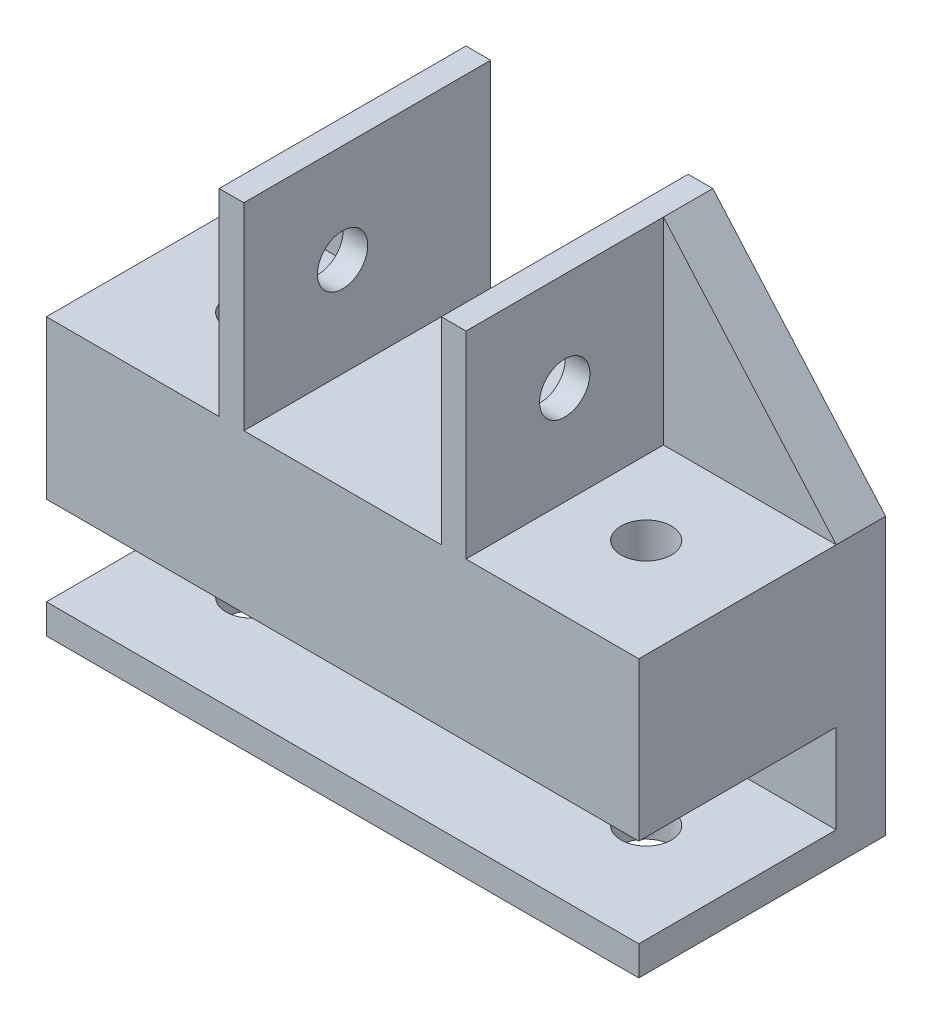
from build123d import *

# Parameters (mm, degrees)
SKETCH1_W             = 20
SKETCH1_H             = 25
BOSS_EXTRUDE1_DEPTH   = 20
BOSS_EXTRUDE1_2_DEPTH = 20
SKETCH1_3_W           = 20
SKETCH1_3_H           = 25
BOSS_EXTRUDE2_DEPTH   = 28
SKETCH2_W             = 60
SKETCH2_H             = 9
CUT_EXTRUDE1_DEPTH    = 20
CUT_EXTRUDE2_DEPTH    = 71.774289117
SKETCH4_W             = 15
SKETCH4_H             = 20
SKETCH4_W_2           = 5
CUT_EXTRUDE3_DEPTH    = 17.5
CUT_EXTRUDE5_DEPTH    = 22.5
SKETCH7_R             = 2.55
CUT_EXTRUDE6_DEPTH    = 71.774289117


with BuildPart() as part:
    # Sketch1 → Boss-Extrude1 (new body)
    with BuildSketch(Plane(origin=(0, 0, 0), x_dir=(1, 0, 0), z_dir=(0, 1, 0))):
        with Locations((10, 12.5)):
            Rectangle(SKETCH1_W, SKETCH1_H)
    extrude(amount=BOSS_EXTRUDE1_DEPTH)



with BuildPart() as body_2:
    # Sketch1 → Boss-Extrude1 2 (new body)
    with BuildSketch(Plane(origin=(0, 0, 0), x_dir=(1, 0, 0), z_dir=(0, 1, 0))):
        with Locations((50, 12.5)):
            Rectangle(SKETCH1_W, SKETCH1_H)
    extrude(amount=BOSS_EXTRUDE1_2_DEPTH)


with BuildPart() as part_1:
    add(part.part)

    add(body_2.part)  # Boss-Extrude2 merges body 2
    # Sketch1<3> → Boss-Extrude2 (add)
    with BuildSketch(Plane(origin=(0, 0, 0), x_dir=(1, 0, 0), z_dir=(0, 1, 0))):
        with Locations((30, 12.5)):
            Rectangle(SKETCH1_3_W, SKETCH1_3_H)
        with Locations((10, 12.5)):
            Rectangle(SKETCH1_3_W, SKETCH1_3_H)
        with Locations((50, 12.5)):
            Rectangle(SKETCH1_3_W, SKETCH1_3_H)
    extrude(amount=-BOSS_EXTRUDE2_DEPTH)

    # Sketch2 → Cut-Extrude1 (cut)
    with BuildSketch(Plane.XY):
        with Locations((30, -20.5)):
            Rectangle(SKETCH2_W, SKETCH2_H)
    extrude(amount=-CUT_EXTRUDE1_DEPTH, mode=Mode.SUBTRACT)

    # Sketch3 → Cut-Extrude2 (cut, through all)
    with BuildSketch(Plane.XY):
        Polygon((0, 20), (0, 0), (17.5, 20), align=None)
        Polygon((42.5, 20), (60, 0), (60, 20), align=None)
    extrude(amount=-CUT_EXTRUDE2_DEPTH, mode=Mode.SUBTRACT)

    # Sketch4 → Cut-Extrude3 (cut)
    with BuildSketch(Plane(origin=(60, 0, 0), x_dir=(0, 0, -1), z_dir=(1, 0, 0))):
        with Locations((12.5, 10)):
            Rectangle(SKETCH4_W, SKETCH4_H)
        with Locations((2.5, 10)):
            Rectangle(SKETCH4_W_2, SKETCH4_H)
    cut_extrude3 = extrude(amount=-CUT_EXTRUDE3_DEPTH, mode=Mode.SUBTRACT)

    # Sketch5 → Cut-Extrude5 (cut)
    with BuildSketch(Plane(origin=(42.5, 0, 0), x_dir=(0, 0, -1), z_dir=(1, 0, 0))):
        with BuildLine():
            ThreePointArc((12.55, 10), (11.803122292, 11.803122292), (10, 12.55))
            Line((10, 12.55), (10, 7.45))
            ThreePointArc((10, 7.45), (11.803122292, 8.196877708), (12.55, 10))
        make_face()
        with BuildLine():
            Line((10, 7.45), (10, 12.55))
            ThreePointArc((10, 12.55), (7.45, 10), (10, 7.45))
        make_face()
    cut_extrude5 = extrude(amount=-CUT_EXTRUDE5_DEPTH, mode=Mode.SUBTRACT)

    # Sketch7 → Cut-Extrude6 (cut, symmetric)
    with BuildSketch(Plane(origin=(0, 0, 0), x_dir=(1, 0, 0), z_dir=(0, 1, 0))):
        with Locations(Location((50, 10.75, 0), (0, 0, 270))):
            Circle(SKETCH7_R)
    cut_extrude6 = extrude(amount=CUT_EXTRUDE6_DEPTH, both=True, mode=Mode.SUBTRACT)

    # Mirror3: Cut-Extrude3, Cut-Extrude5, Cut-Extrude6 across plane
    add(cut_extrude3.mirror(Plane.ZY.offset(-30)), mode=Mode.SUBTRACT)
    add(cut_extrude5.mirror(Plane.ZY.offset(-30)), mode=Mode.SUBTRACT)
    add(cut_extrude6.mirror(Plane.ZY.offset(-30)), mode=Mode.SUBTRACT)


solid = part_1.part
